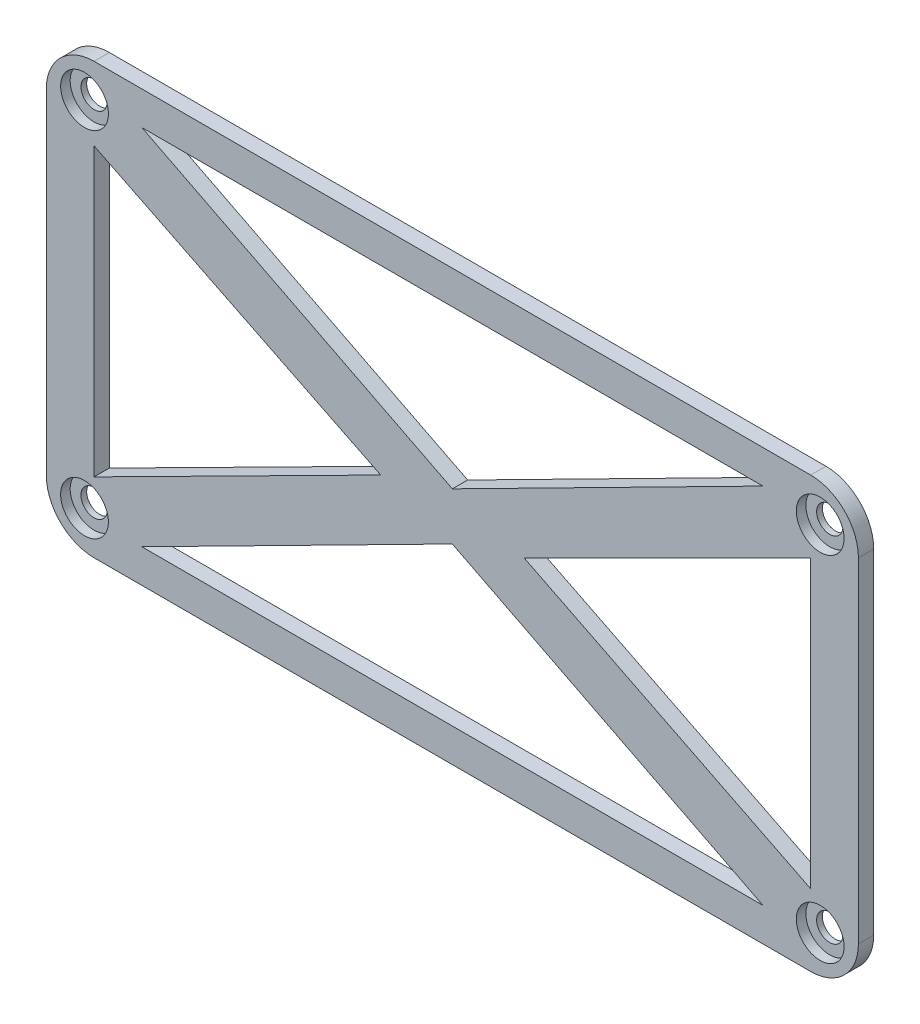
from build123d import *

# Parameters (mm, degrees)
EXTRUDE_1_DEPTH          = 3.2
CUT_EXTRUDE_1_DEPTH      = 39
CUT_EXTRUDE_1_DEPTH_BACK = 10
SKETCH_2_R               = 2.75
SKETCH_3_R               = 5
CUT_EXTRUDE_2_DEPTH      = 2


with BuildPart() as part:
    # 草图1 → 凸台-拉伸1 (new body)
    with BuildSketch(Plane.XY):
        with BuildLine():
            Line((-72.574116531, 45.487390308), (77.425883469, 45.487390308))
            ThreePointArc((77.425883469, 45.487390308), (84.496951281, 42.558458119), (87.425883469, 35.487390308))
            Line((87.425883469, 35.487390308), (87.425883469, -34.512609692))
            ThreePointArc((87.425883469, -34.512609692), (84.496951281, -41.583677504), (77.425883469, -44.512609692))
            Line((77.425883469, -44.512609692), (-72.574116531, -44.512609692))
            ThreePointArc((-72.574116531, -44.512609692), (-79.645184343, -41.583677504), (-82.574116531, -34.512609692))
            Line((-82.574116531, -34.512609692), (-82.574116531, 35.487390308))
            ThreePointArc((-82.574116531, 35.487390308), (-79.645184343, 42.558458119), (-72.574116531, 45.487390308))
        make_face()
    extrude(amount=EXTRUDE_1_DEPTH)

    # 草图2 → 切除-拉伸1 (cut, two sides: drawn at the far end of the back side and taken through both)
    with BuildSketch(Plane.XY.offset(3.2).offset(-CUT_EXTRUDE_1_DEPTH_BACK)):
        with Locations((-74.574116531, 37.487390308)):
            Circle(SKETCH_2_R)
        with Locations((-74.574116531, -36.512609692)):
            Circle(SKETCH_2_R)
        with Locations((79.425883469, 37.487390308)):
            Circle(SKETCH_2_R)
        with Locations((79.425883469, -36.512609692)):
            Circle(SKETCH_2_R)
        Polygon((-62.574116531, 38.487390308), (2.425883469, 5.487390308), (67.425883469, 38.487390308), align=None)
        Polygon((-72.574116531, 30.156085606), (-12.574116531, 0.487390308), (-72.574116531, -29.843914394), align=None)
        Polygon((2.425883469, -4.512609692), (-62.574116531, -37.512609692), (67.425883469, -37.512609692), align=None)
        Polygon((17.425883469, 0.487390308), (77.425883469, 30.487390308), (77.425883469, -29.512609692), align=None)
    extrude(amount=CUT_EXTRUDE_1_DEPTH + CUT_EXTRUDE_1_DEPTH_BACK, mode=Mode.SUBTRACT)

    # 草图3 → 切除-拉伸2 (cut)
    with BuildSketch(Plane.XY.offset(3.2)):
        with Locations((-74.574116531, 37.487390308)):
            Circle(SKETCH_3_R)
        with Locations((79.425883469, 37.487390308)):
            Circle(SKETCH_3_R)
        with Locations((79.425883469, -36.512609692)):
            Circle(SKETCH_3_R)
        with Locations((-74.574116531, -36.512609692)):
            Circle(SKETCH_3_R)
    extrude(amount=-CUT_EXTRUDE_2_DEPTH, mode=Mode.SUBTRACT)


solid = part.part
